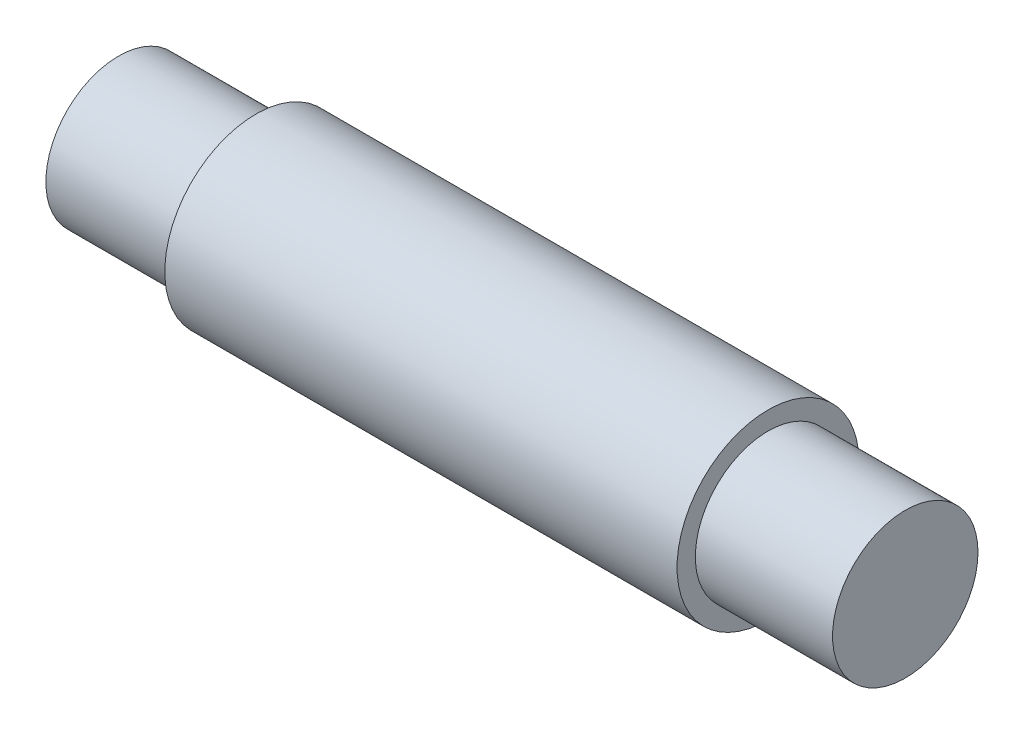
from build123d import *


with BuildPart() as part:
    # Croquis1 → Revolución1 (revolve)
    with BuildSketch(Plane.XY, mode=Mode.PRIVATE) as revoluci_n1_sk:
        Polygon((43, 0), (-43, 0), (-43, 7.95), (-28, 7.95), (-28, 9.95), (28, 9.95), (28, 7.95), (43, 7.95), align=None)
    revolve(revoluci_n1_sk.sketch.rotate(Axis((64.022222222, 0, 0), (-1, 0, 0)), 90), axis=Axis((64.022222222, 0, 0), (-1, 0, 0)))


solid = part.part
